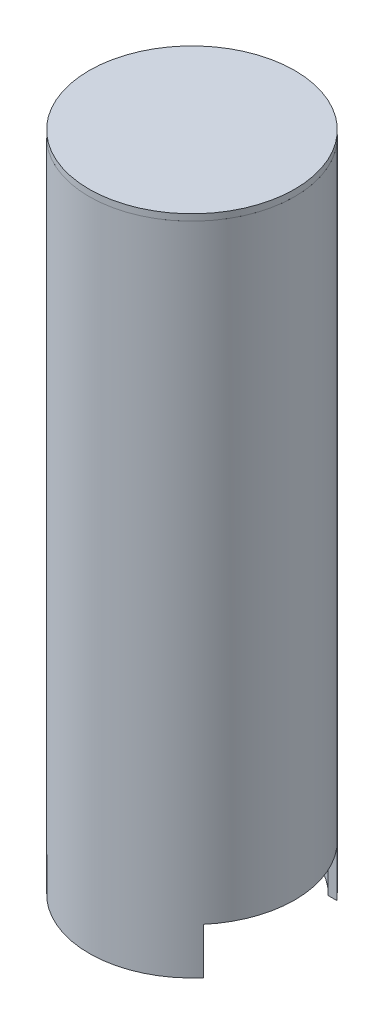
from build123d import *

# Parameters (mm, degrees)
SKETCH1_R                = 50.8
BASE_DEPTH               = 323.85
SKETCH3_R                = 47.625
BOTTOM_CUT_DEPTH         = 25.4
SKETCH4_W                = 66.04
SKETCH4_H                = 22.86
BOTTOM_SIDE_DEPTH        = 58.42
SKETCH5_R                = 47.625
INSIDE_CUT_DEPTH         = 306.740465755
SKETCH6_R                = 3.175
RED_ON_BOTTOM_DEPTH      = 1.905
SKETCH7_R                = 1.905
BLACK_ON_RED_DEPTH       = 0.635
SKETCH8_R                = 46.99
CAP_TOP_DEPTH            = 5.715
SKETCH9_R                = 50.8
CAP_BOTTOM_PORTION_DEPTH = 3.175
SKETCH11_R               = 1.27
CONNECTION_CUT_DEPTH     = 1.778


with BuildPart() as part:
    # Sketch1 → Base (new body)
    with BuildSketch(Plane(origin=(0, 0, 0), x_dir=(1, 0, 0), z_dir=(0, 1, 0))):
        with Locations(Location((0, 0, 0), (0, 0, 270))):
            Circle(SKETCH1_R)
    extrude(amount=BASE_DEPTH)

    # Sketch3 → Bottom Cut (cut)
    with BuildSketch(Plane(origin=(0, 0, 0), x_dir=(-1, 0, 0), z_dir=(0, -1, 0))):
        with Locations(Location((0, 0, 0), (0, 0, 90))):
            Circle(SKETCH3_R)
    extrude(amount=-BOTTOM_CUT_DEPTH, mode=Mode.SUBTRACT)

    # Sketch4 → Bottom Side (cut)
    with BuildSketch(Plane(origin=(0, 0, 0), x_dir=(0, 0, -1), z_dir=(1, 0, 0))):
        with Locations((0, 11.43)):
            Rectangle(SKETCH4_W, SKETCH4_H)
    extrude(amount=BOTTOM_SIDE_DEPTH, mode=Mode.SUBTRACT)

    # Sketch5 → Inside Cut (cut, through all)
    with BuildSketch(Plane(origin=(0, 26.67, 0), x_dir=(1, 0, 0), z_dir=(0, 1, 0))):
        with Locations(Location((0, 0, 0), (0, 0, 90))):
            Circle(SKETCH5_R)
    extrude(amount=INSIDE_CUT_DEPTH, mode=Mode.SUBTRACT)

    # Sketch11 → Connection cut (cut)
    with BuildSketch(Plane.XZ.offset(-25.4)):
        with Locations(Location((0, 0, 0), (0, 0, 270))):
            Circle(SKETCH11_R)
    extrude(amount=-CONNECTION_CUT_DEPTH, mode=Mode.SUBTRACT)


with BuildPart() as body_2:
    # Sketch6 → Red on bottom (new body)
    with BuildSketch(Plane(origin=(0, 26.67, 0), x_dir=(1, 0, 0), z_dir=(0, 1, 0))):
        with Locations(Location((0, 0, 0), (0, 0, 90))):
            Circle(SKETCH6_R)
    extrude(amount=RED_ON_BOTTOM_DEPTH)


with BuildPart() as body_3:
    # Sketch7 → Black on red (new body)
    with BuildSketch(Plane(origin=(0, 28.575, 0), x_dir=(1, 0, 0), z_dir=(0, 1, 0))):
        with Locations(Location((0, 0, 0), (0, 0, 270))):
            Circle(SKETCH7_R)
    extrude(amount=BLACK_ON_RED_DEPTH)


with BuildPart() as body_4:
    # Sketch8 → Cap top (new body)
    with BuildSketch(Plane(origin=(0, 323.85, 0), x_dir=(1, 0, 0), z_dir=(0, 1, 0))):
        with Locations(Location((0, 0, 0), (0, 0, 270))):
            Circle(SKETCH8_R)
    extrude(amount=-CAP_TOP_DEPTH)


with BuildPart() as body_5:
    # Sketch9 → cap bottom portion (new body)
    with BuildSketch(Plane(origin=(0, 323.85, 0), x_dir=(1, 0, 0), z_dir=(0, 1, 0))):
        with Locations(Location((0, 0, 0), (0, 0, 40.541601874))):
            Circle(SKETCH9_R)
    extrude(amount=CAP_BOTTOM_PORTION_DEPTH)


with BuildPart() as body_4_1:
    add(body_4.part)

    # Cap Body: union body 5
    add(body_5.part)


with BuildPart() as body_2_1:
    add(body_2.part)

    # Connector Body: union body 3
    add(body_3.part)


solid = Compound([part.part, body_4_1.part, body_2_1.part])
